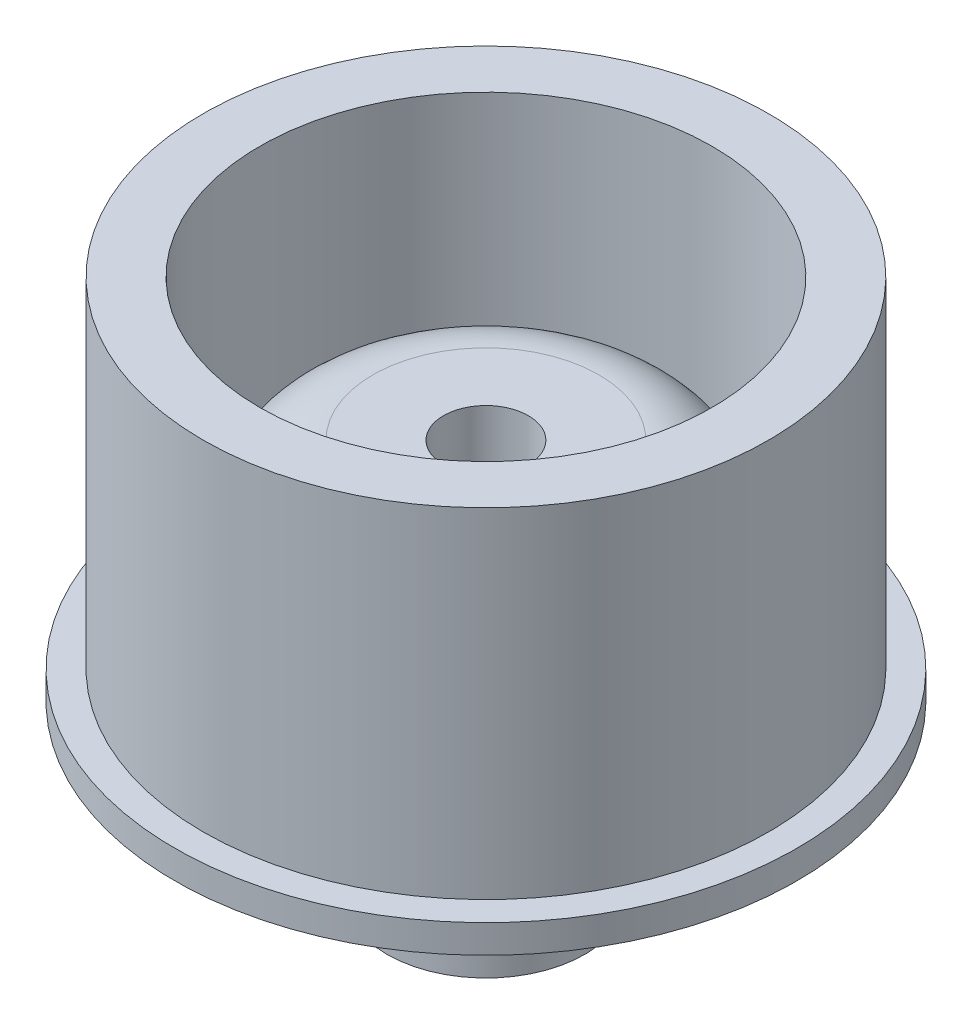
from build123d import *

# Parameters (mm, degrees)
SKETCH_1_R               = 10
EXTRUDE_1_DEPTH          = 12
SKETCH_2_R               = 11
EXTRUDE_2_DEPTH          = 1
CUT_EXTRUDE_1_DEPTH      = 21.273134933
CUT_EXTRUDE_1_DEPTH_BACK = 6
SKETCH_3_R               = 5
SKETCH_3_R_2             = 3.5
EXTRUDE_START            = 6
SKETCH_5_R               = 3.5
EXTRUDE_3_DEPTH          = 6
SHELL_1_T                = -2
FILLET_1_R               = 3


with BuildPart() as part:
    # ｽｹｯﾁ1 → ﾎﾞｽ - 押し出し1 (new body)
    with BuildSketch(Plane(origin=(0, 0, 0), x_dir=(1, 0, 0), z_dir=(0, 1, 0))):
        with Locations(Location((0, 0, 0), (0, 0, 270))):
            Circle(SKETCH_1_R)
    extrude(amount=EXTRUDE_1_DEPTH)

    # ｽｹｯﾁ2 → ﾎﾞｽ - 押し出し2 (add)
    with BuildSketch(Plane.XZ):
        with Locations(Location((0, 0, 0), (0, 0, 270))):
            Circle(SKETCH_2_R)
    extrude(amount=EXTRUDE_2_DEPTH)

    # ｽｹｯﾁ3 → ｶｯﾄ - 押し出し1 (cut, two sides: drawn at the far end of the back side and taken through both)
    with BuildSketch(Plane.XZ.offset(1).offset(-CUT_EXTRUDE_1_DEPTH_BACK)):
        with Locations(Location((0, 0, 0), (0, 0, 90))):
            Circle(SKETCH_3_R)
        with Locations(Location((0, 0, 0), (0, 0, 90))):
            Circle(SKETCH_3_R_2, mode=Mode.SUBTRACT)
    extrude(amount=CUT_EXTRUDE_1_DEPTH + CUT_EXTRUDE_1_DEPTH_BACK, mode=Mode.SUBTRACT)

    # ｽｹｯﾁ5 → ﾎﾞｽ - 押し出し3 (add)
    with BuildSketch(Plane.XZ.offset(1).offset(EXTRUDE_START)):
        with Locations(Location((0, 0, 0), (0, 0, 90))):
            Circle(SKETCH_5_R)
    extrude(amount=-EXTRUDE_3_DEPTH)

    # ｼｪﾙ1
    shell_1_openings = [part.faces().sort_by_distance(p)[0] for p in [
        (0, 12, 0),
    ]]
    offset(amount=SHELL_1_T, openings=shell_1_openings, kind=Kind.INTERSECTION)

    # ﾌｨﾚｯﾄ1
    fillet_1_edges = [part.edges().sort_by_distance(p)[0] for p in [
        (0, 7, -7),
    ]]
    fillet(fillet_1_edges, radius=FILLET_1_R)


solid = part.part
